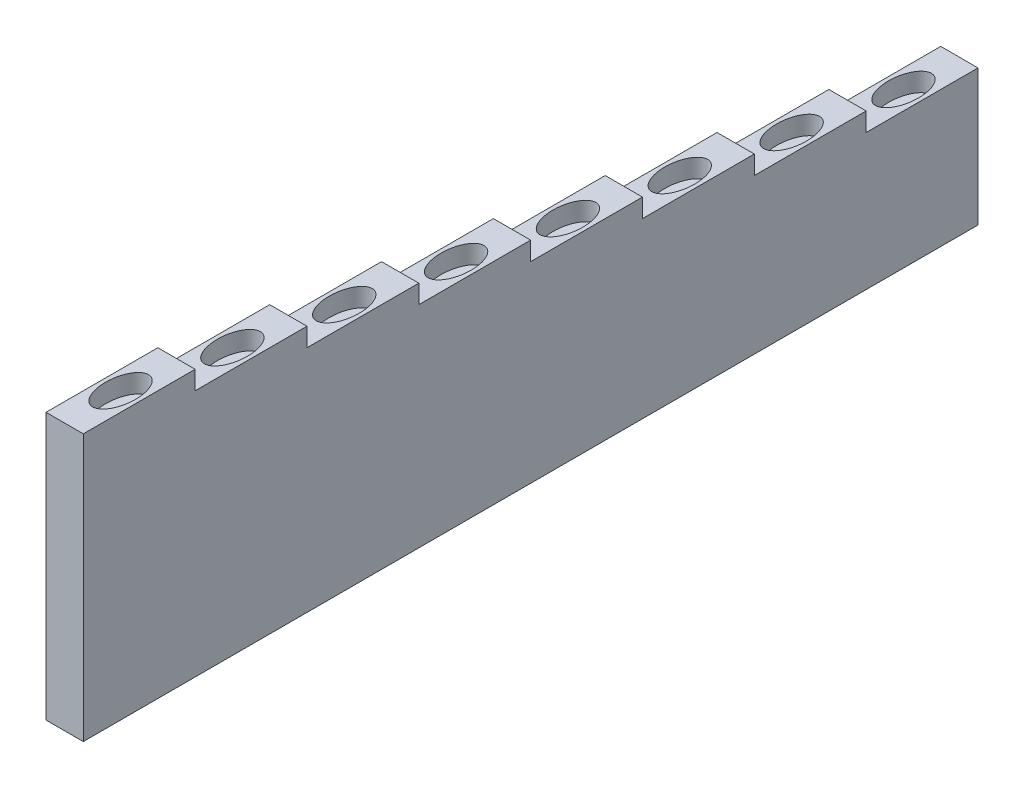
from build123d import *

# Parameters (mm, degrees)
BOSS_EXTRUDE1_DEPTH      = 48
CUT_EXTRUDE4_DEPTH       = 2
CUT_EXTRUDE6_DEPTH       = 9
CUT_EXTRUDE6_DEPTH_BACK  = 1
SKETCH8_RX               = 1.5
SKETCH8_RY               = 0.8
CUT_EXTRUDE7_DEPTH       = 11
CUT_EXTRUDE7_DEPTH_BACK  = 1
SKETCH13_RX              = 1.5
SKETCH13_RY              = 0.8
CUT_EXTRUDE8_DEPTH       = 13
CUT_EXTRUDE8_DEPTH_BACK  = 1
SKETCH14_RX              = 1.5
SKETCH14_RY              = 0.8
CUT_EXTRUDE9_DEPTH       = 15
CUT_EXTRUDE9_DEPTH_BACK  = 1
SKETCH15_RX              = 1.5
SKETCH15_RY              = 0.8
CUT_EXTRUDE10_DEPTH      = 17
CUT_EXTRUDE10_DEPTH_BACK = 1
SKETCH16_RX              = 1.5
SKETCH16_RY              = 0.8
CUT_EXTRUDE11_DEPTH      = 19
CUT_EXTRUDE11_DEPTH_BACK = 1
SKETCH17_RX              = 1.5
SKETCH17_RY              = 0.8
CUT_EXTRUDE12_DEPTH      = 21
CUT_EXTRUDE12_DEPTH_BACK = 1
SKETCH18_RX              = 1.5
SKETCH18_RY              = 0.8
CUT_EXTRUDE13_DEPTH      = 23
CUT_EXTRUDE13_DEPTH_BACK = 1
SKETCH19_RX              = 1.5
SKETCH19_RY              = 0.8
SKETCH21_W               = 58.141640115
SKETCH21_H               = 26.059597095
CUT_EXTRUDE14_DEPTH      = 22
BODY_MOVE_COPY1_ANGLE    = 180


with BuildPart() as part:
    # Sketch2 → Boss-Extrude1 (new body)
    with BuildSketch(Plane.XY):
        Polygon((-7.23, -20.3), (-7.23, -34), (-9.23, -34), (-9.23, -2), (-7.23, -2), align=None)
    extrude(amount=BOSS_EXTRUDE1_DEPTH)

    # Sketch7 → Cut-Extrude4 (cut)
    with BuildSketch(Plane(origin=(-7.23, 0, 0), x_dir=(0, 0, -1), z_dir=(1, 0, 0))):
        Polygon((-48, -16.3), (-48, -24.3), (-42, -24.3), (-42, -25.3), (-36, -25.3), (-36, -26.3), (-30, -26.3), (-30, -27.3), (-24, -27.3), (-24, -28.3), (-18, -28.3), (-18, -29.3), (-12, -29.3), (-12, -30.3), (-6, -30.3), (-6, -31.3), (0, -31.3), (0, -9.3), (-6, -9.3), (-6, -10.3), (-12, -10.3), (-12, -11.3), (-18, -11.3), (-18, -12.3), (-24, -12.3), (-24, -13.3), (-30, -13.3), (-30, -14.3), (-36, -14.3), (-36, -15.3), (-42, -15.3), (-42, -16.3), align=None)
    extrude(amount=-CUT_EXTRUDE4_DEPTH, mode=Mode.SUBTRACT)


with BuildPart() as cut_extrude4_piece_1:
    # of the separate pieces the step leaves, piece 1, a body of its own (cut_extrude4_pieces)
    add(part.part.solids().sort_by_distance((-7.23, -9.3, 0))[0])


with BuildPart() as cut_extrude4_piece_2:
    # of the separate pieces the step leaves, piece 2, a body of its own (cut_extrude4_pieces)
    add(part.part.solids().sort_by_distance((-7.23, -34, 0))[0])


with BuildPart() as cut_extrude6_tool:
    # Sketch8 → Cut-Extrude6 (new, two sides: drawn at the far end of the back side and taken through both)
    with BuildSketch(Plane(origin=(0, -24.3, 0), x_dir=(1, 0, 0), z_dir=(0, 1, 0)).offset(-CUT_EXTRUDE6_DEPTH_BACK)):
        with Locations(Location((-8.23, -45), (0, 0, 90))):
            Ellipse(SKETCH8_RX, SKETCH8_RY)
    extrude(amount=CUT_EXTRUDE6_DEPTH + CUT_EXTRUDE6_DEPTH_BACK)


with BuildPart() as cut_extrude4_piece_1_1:
    add(cut_extrude4_piece_1.part)

    # Cut-Extrude6: cut by cut_extrude6_tool
    add(cut_extrude6_tool.part, mode=Mode.SUBTRACT)


with BuildPart() as cut_extrude4_piece_2_1:
    add(cut_extrude4_piece_2.part)

    # Cut-Extrude6: cut by cut_extrude6_tool
    add(cut_extrude6_tool.part, mode=Mode.SUBTRACT)


with BuildPart() as cut_extrude7_tool:
    # Sketch13 → Cut-Extrude7 (new, two sides: drawn at the far end of the back side and taken through both)
    with BuildSketch(Plane(origin=(0, -25.3, 0), x_dir=(1, 0, 0), z_dir=(0, 1, 0)).offset(-CUT_EXTRUDE7_DEPTH_BACK)):
        with Locations(Location((-8.23, -39), (0, 0, 90))):
            Ellipse(SKETCH13_RX, SKETCH13_RY)
    extrude(amount=CUT_EXTRUDE7_DEPTH + CUT_EXTRUDE7_DEPTH_BACK)


with BuildPart() as cut_extrude4_piece_1_2:
    add(cut_extrude4_piece_1_1.part)

    # Cut-Extrude7: cut by cut_extrude7_tool
    add(cut_extrude7_tool.part, mode=Mode.SUBTRACT)


with BuildPart() as cut_extrude4_piece_2_2:
    add(cut_extrude4_piece_2_1.part)

    # Cut-Extrude7: cut by cut_extrude7_tool
    add(cut_extrude7_tool.part, mode=Mode.SUBTRACT)


with BuildPart() as cut_extrude8_tool:
    # Sketch14 → Cut-Extrude8 (new, two sides: drawn at the far end of the back side and taken through both)
    with BuildSketch(Plane(origin=(0, -26.3, 0), x_dir=(1, 0, 0), z_dir=(0, 1, 0)).offset(-CUT_EXTRUDE8_DEPTH_BACK)):
        with Locations(Location((-8.23, -33), (0, 0, 90))):
            Ellipse(SKETCH14_RX, SKETCH14_RY)
    extrude(amount=CUT_EXTRUDE8_DEPTH + CUT_EXTRUDE8_DEPTH_BACK)


with BuildPart() as cut_extrude4_piece_1_3:
    add(cut_extrude4_piece_1_2.part)

    # Cut-Extrude8: cut by cut_extrude8_tool
    add(cut_extrude8_tool.part, mode=Mode.SUBTRACT)


with BuildPart() as cut_extrude4_piece_2_3:
    add(cut_extrude4_piece_2_2.part)

    # Cut-Extrude8: cut by cut_extrude8_tool
    add(cut_extrude8_tool.part, mode=Mode.SUBTRACT)


with BuildPart() as cut_extrude9_tool:
    # Sketch15 → Cut-Extrude9 (new, two sides: drawn at the far end of the back side and taken through both)
    with BuildSketch(Plane(origin=(0, -27.3, 0), x_dir=(1, 0, 0), z_dir=(0, 1, 0)).offset(-CUT_EXTRUDE9_DEPTH_BACK)):
        with Locations(Location((-8.23, -27), (0, 0, 90))):
            Ellipse(SKETCH15_RX, SKETCH15_RY)
    extrude(amount=CUT_EXTRUDE9_DEPTH + CUT_EXTRUDE9_DEPTH_BACK)


with BuildPart() as cut_extrude4_piece_1_4:
    add(cut_extrude4_piece_1_3.part)

    # Cut-Extrude9: cut by cut_extrude9_tool
    add(cut_extrude9_tool.part, mode=Mode.SUBTRACT)


with BuildPart() as cut_extrude4_piece_2_4:
    add(cut_extrude4_piece_2_3.part)

    # Cut-Extrude9: cut by cut_extrude9_tool
    add(cut_extrude9_tool.part, mode=Mode.SUBTRACT)


with BuildPart() as cut_extrude10_tool:
    # Sketch16 → Cut-Extrude10 (new, two sides: drawn at the far end of the back side and taken through both)
    with BuildSketch(Plane(origin=(0, -28.3, 0), x_dir=(1, 0, 0), z_dir=(0, 1, 0)).offset(-CUT_EXTRUDE10_DEPTH_BACK)):
        with Locations(Location((-8.23, -21), (0, 0, 90))):
            Ellipse(SKETCH16_RX, SKETCH16_RY)
    extrude(amount=CUT_EXTRUDE10_DEPTH + CUT_EXTRUDE10_DEPTH_BACK)


with BuildPart() as cut_extrude4_piece_1_5:
    add(cut_extrude4_piece_1_4.part)

    # Cut-Extrude10: cut by cut_extrude10_tool
    add(cut_extrude10_tool.part, mode=Mode.SUBTRACT)


with BuildPart() as cut_extrude4_piece_2_5:
    add(cut_extrude4_piece_2_4.part)

    # Cut-Extrude10: cut by cut_extrude10_tool
    add(cut_extrude10_tool.part, mode=Mode.SUBTRACT)


with BuildPart() as cut_extrude11_tool:
    # Sketch17 → Cut-Extrude11 (new, two sides: drawn at the far end of the back side and taken through both)
    with BuildSketch(Plane(origin=(0, -29.3, 0), x_dir=(1, 0, 0), z_dir=(0, 1, 0)).offset(-CUT_EXTRUDE11_DEPTH_BACK)):
        with Locations(Location((-8.23, -15), (0, 0, 90))):
            Ellipse(SKETCH17_RX, SKETCH17_RY)
    extrude(amount=CUT_EXTRUDE11_DEPTH + CUT_EXTRUDE11_DEPTH_BACK)


with BuildPart() as cut_extrude4_piece_1_6:
    add(cut_extrude4_piece_1_5.part)

    # Cut-Extrude11: cut by cut_extrude11_tool
    add(cut_extrude11_tool.part, mode=Mode.SUBTRACT)


with BuildPart() as cut_extrude4_piece_2_6:
    add(cut_extrude4_piece_2_5.part)

    # Cut-Extrude11: cut by cut_extrude11_tool
    add(cut_extrude11_tool.part, mode=Mode.SUBTRACT)


with BuildPart() as cut_extrude12_tool:
    # Sketch18 → Cut-Extrude12 (new, two sides: drawn at the far end of the back side and taken through both)
    with BuildSketch(Plane(origin=(0, -30.3, 0), x_dir=(1, 0, 0), z_dir=(0, 1, 0)).offset(-CUT_EXTRUDE12_DEPTH_BACK)):
        with Locations(Location((-8.23, -9), (0, 0, 90))):
            Ellipse(SKETCH18_RX, SKETCH18_RY)
    extrude(amount=CUT_EXTRUDE12_DEPTH + CUT_EXTRUDE12_DEPTH_BACK)


with BuildPart() as cut_extrude4_piece_1_7:
    add(cut_extrude4_piece_1_6.part)

    # Cut-Extrude12: cut by cut_extrude12_tool
    add(cut_extrude12_tool.part, mode=Mode.SUBTRACT)


with BuildPart() as cut_extrude4_piece_2_7:
    add(cut_extrude4_piece_2_6.part)

    # Cut-Extrude12: cut by cut_extrude12_tool
    add(cut_extrude12_tool.part, mode=Mode.SUBTRACT)


with BuildPart() as cut_extrude13_tool:
    # Sketch19 → Cut-Extrude13 (new, two sides: drawn at the far end of the back side and taken through both)
    with BuildSketch(Plane(origin=(0, -31.3, 0), x_dir=(1, 0, 0), z_dir=(0, 1, 0)).offset(-CUT_EXTRUDE13_DEPTH_BACK)):
        with Locations(Location((-8.23, -3), (0, 0, 90))):
            Ellipse(SKETCH19_RX, SKETCH19_RY)
    extrude(amount=CUT_EXTRUDE13_DEPTH + CUT_EXTRUDE13_DEPTH_BACK)


with BuildPart() as cut_extrude4_piece_1_8:
    add(cut_extrude4_piece_1_7.part)

    # Cut-Extrude13: cut by cut_extrude13_tool
    add(cut_extrude13_tool.part, mode=Mode.SUBTRACT)


with BuildPart() as cut_extrude4_piece_2_8:
    add(cut_extrude4_piece_2_7.part)

    # Cut-Extrude13: cut by cut_extrude13_tool
    add(cut_extrude13_tool.part, mode=Mode.SUBTRACT)

    # Sketch21 → Cut-Extrude14 (cut)
    with BuildSketch(Plane(origin=(0, 0, 0), x_dir=(0, 0, -1), z_dir=(1, 0, 0))):
        with Locations((-20.055207527, -35.194061722)):
            Rectangle(SKETCH21_W, SKETCH21_H)
    extrude(amount=-CUT_EXTRUDE14_DEPTH, mode=Mode.SUBTRACT)


with BuildPart() as cut_extrude4_piece_1_9:
    # Body-Move/Copy1: moved
    add(cut_extrude4_piece_1_8.part.rotate(Axis((-8.23, -9.15, 0), (0, 0, 1)), BODY_MOVE_COPY1_ANGLE))


solid = cut_extrude4_piece_1_9.part
